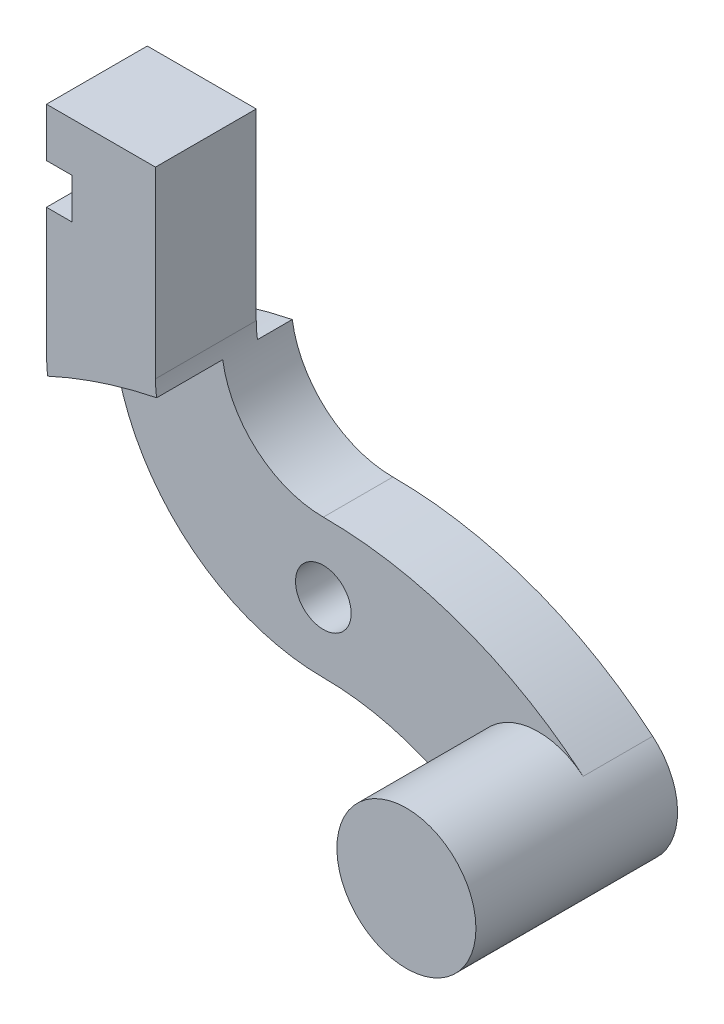
from build123d import *

# Parameters (mm, degrees)
SKETCH_8_R          = 4
EXTRUDE_2549_DEPTH  = 10
SKETCH_9_R          = 10
EXTRUDE_3976_DEPTH  = 29
EXTRUDE_1_DEPTH     = 19.5
CUT_EXTRUDE_1_DEPTH = 5


with BuildPart() as part:
    # Эскиз основа<8> → Extrude 2549 (new body)
    with BuildSketch(Plane.XY):
        with BuildLine():
            ThreePointArc((-30.165303473, 65.376253077), (-20.317568692, 45.96310484), (0, 38.15))
            ThreePointArc((0, 38.15), (13.048068468, 35.849273483), (24.52234731, 29.224595505))
            ThreePointArc((24.52234731, 29.224595505), (23.289778975, 43.312916033), (37.378099503, 44.545484367))
            ThreePointArc((37.378099503, 44.545484367), (19.888471334, 54.643125899), (0, 58.15))
            ThreePointArc((0, 58.15), (-9.523070426, 61.66726776), (-14.473600663, 70.530240917))
            ThreePointArc((-14.473600663, 70.530240917), (-22.467728819, 68.404686694), (-30.165303473, 65.376253077))
        make_face()
        with Locations((0, 48.15)):
            Circle(SKETCH_8_R, mode=Mode.SUBTRACT)
    extrude(amount=EXTRUDE_2549_DEPTH)

    # Sketch 9 → Extrude 3976 (add)
    with BuildSketch(Plane.XY):
        with Locations((30.950223406, 36.885039936)):
            Circle(SKETCH_9_R)
    extrude(amount=EXTRUDE_3976_DEPTH)

    # Эскиз основа<11> → Бобышка-Вытянуть1 (add)
    with BuildSketch(Plane.XY):
        with BuildLine():
            ThreePointArc((-30.323937444, 68.473937444), (-30.284252984, 66.923065659), (-30.165303473, 65.376253077))
            ThreePointArc((-30.165303473, 65.376253077), (-22.467728819, 68.404686694), (-14.473600663, 70.530240917))
            ThreePointArc((-14.473600663, 70.530240917), (-14.606270011, 71.661967819), (-14.650582479, 72.800582479))
            Line((-14.650582479, 72.800582479), (-14.650582479, 99.176328781))
            Line((-14.650582479, 99.176328781), (-30.323937444, 99.176328781))
            Line((-30.323937444, 99.176328781), (-30.323937444, 92.15))
            Line((-30.323937444, 92.15), (-26.682795781, 92.15))
            Line((-26.682795781, 92.15), (-26.682795781, 86.338672823))
            Line((-26.682795781, 86.338672823), (-30.323937444, 86.338672823))
            Line((-30.323937444, 86.338672823), (-30.323937444, 68.473937444))
        make_face()
    extrude(amount=EXTRUDE_1_DEPTH)

    # Эскиз основа<12> → Вырез-Вытянуть1 (cut)
    with BuildSketch(Plane.XY):
        with BuildLine():
            ThreePointArc((-30.323937444, 68.473937444), (-30.284252984, 66.923065659), (-30.165303473, 65.376253077))
            ThreePointArc((-30.165303473, 65.376253077), (-22.467728819, 68.404686694), (-14.473600663, 70.530240917))
            ThreePointArc((-14.473600663, 70.530240917), (-14.606270011, 71.661967819), (-14.650582479, 72.800582479))
            Line((-14.650582479, 72.800582479), (-14.650582479, 99.176328781))
            Line((-14.650582479, 99.176328781), (-30.323937444, 99.176328781))
            Line((-30.323937444, 99.176328781), (-30.323937444, 92.15))
            Line((-30.323937444, 92.15), (-26.682795781, 92.15))
            Line((-26.682795781, 92.15), (-26.682795781, 86.338672823))
            Line((-26.682795781, 86.338672823), (-30.323937444, 86.338672823))
            Line((-30.323937444, 86.338672823), (-30.323937444, 68.473937444))
        make_face()
    extrude(amount=CUT_EXTRUDE_1_DEPTH, mode=Mode.SUBTRACT)


solid = part.part
